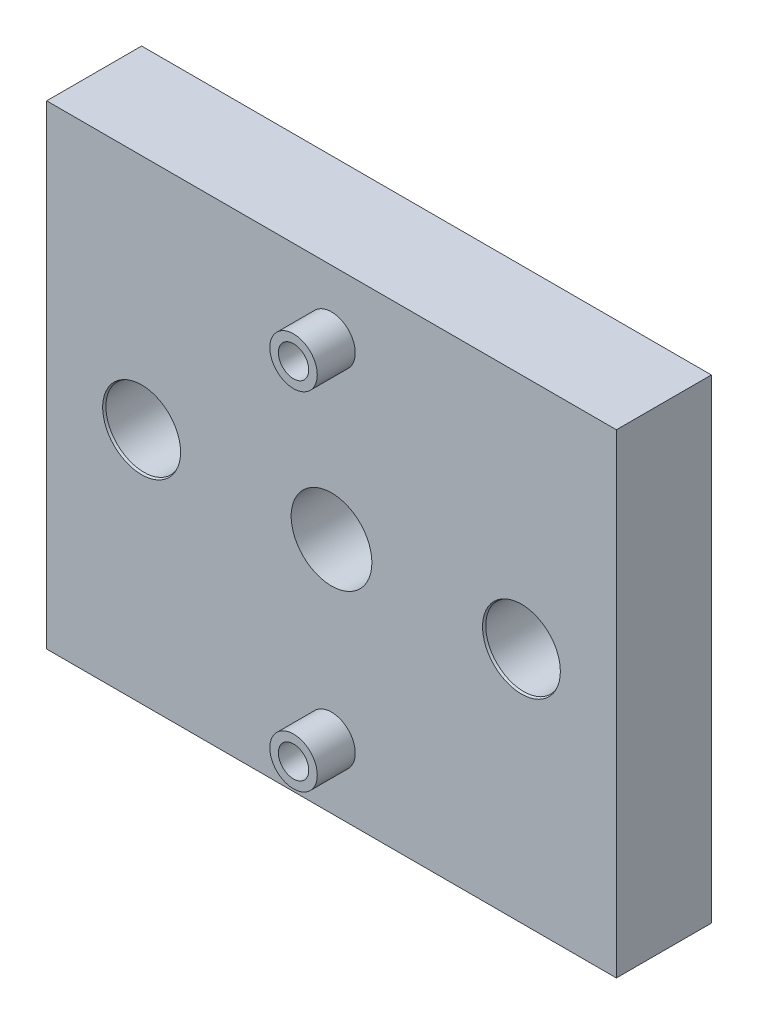
from build123d import *

# Parameters (mm, degrees)
SKETCH_1_W                = 60
SKETCH_1_H                = 50
EXTRUDE_1_DEPTH           = 10
HOLE_WIZARD_1_D           = 8.5
HOLE_WIZARD_1_DEPTH       = 20
HOLE_WIZARD_2_D           = 8
HOLE_WIZARD_2_CSINK_D     = 8.2
HOLE_WIZARD_2_CSINK_ANGLE = 45
SKETCH_9_R                = 2.5
EXTRUDE_3_DEPTH           = 4
HOLE_WIZARD_3_D           = 3.2


with BuildPart() as part:
    # 草图1 → 凸台-拉伸1 (new body)
    with BuildSketch(Plane.XY):
        Rectangle(SKETCH_1_W, SKETCH_1_H)
    extrude(amount=EXTRUDE_1_DEPTH)

    # 孔1
    with Locations(Plane.XY.offset(10)):
        with Locations((0, 0)):
            Hole(HOLE_WIZARD_1_D / 2, depth=HOLE_WIZARD_1_DEPTH)

    # 孔2 (through all)
    with Locations(Plane.XY.offset(10)):
        with Locations((20, 0), (-20, 0)):
            CounterSinkHole(HOLE_WIZARD_2_D / 2, HOLE_WIZARD_2_CSINK_D / 2, counter_sink_angle=HOLE_WIZARD_2_CSINK_ANGLE)

    # 草图9 → 凸台-拉伸3 (add)
    with BuildSketch(Plane.XY.offset(10)):
        with Locations(Location((0, 18.25, 0), (0, 0, 180))):
            Circle(SKETCH_9_R)
        with Locations(Location((0, -18.25, 0), (0, 0, 180))):
            Circle(SKETCH_9_R)
    extrude(amount=EXTRUDE_3_DEPTH)

    # 孔3 (through all)
    with Locations(Plane.XY.offset(14)):
        with Locations((0, 18.25), (0, -18.25)):
            Hole(HOLE_WIZARD_3_D / 2)


solid = part.part
